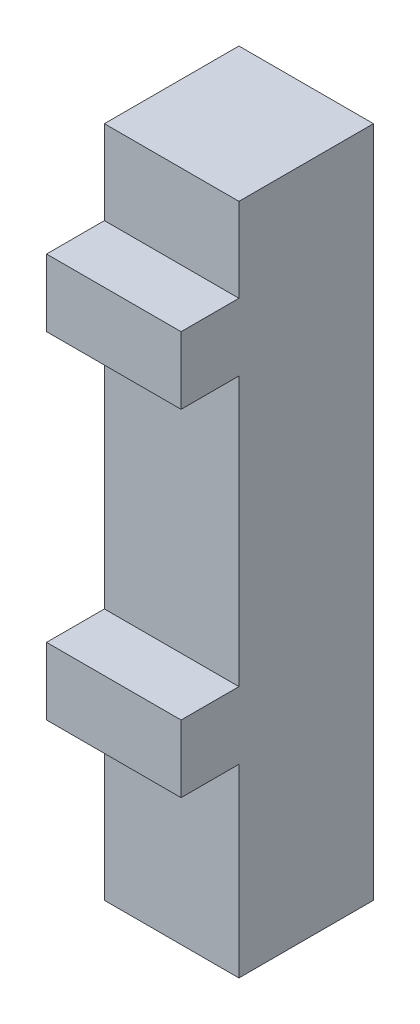
from build123d import *

# Parameters (mm, degrees)
SKETCH1_W           = 100
SKETCH1_H           = 100
BOSS_EXTRUDE1_DEPTH = 500
SKETCH2_W           = 100
SKETCH2_H           = 50
BOSS_EXTRUDE2_DEPTH = 43


with BuildPart() as part:
    # Sketch1 → Boss-Extrude1 (new body)
    with BuildSketch(Plane(origin=(0, 0, 0), x_dir=(1, 0, 0), z_dir=(0, 1, 0))):
        with Locations((19.377593361, -29.709543568)):
            Rectangle(SKETCH1_W, SKETCH1_H)
    extrude(amount=BOSS_EXTRUDE1_DEPTH)

    # Sketch2 → Boss-Extrude2 (add)
    with BuildSketch(Plane.XY.offset(79.709543568)):
        with Locations((19.377593361, 412.588238816)):
            Rectangle(SKETCH2_W, SKETCH2_H)
        with Locations((19.377593361, 162.588238816)):
            Rectangle(SKETCH2_W, SKETCH2_H)
    extrude(amount=BOSS_EXTRUDE2_DEPTH)


solid = part.part
